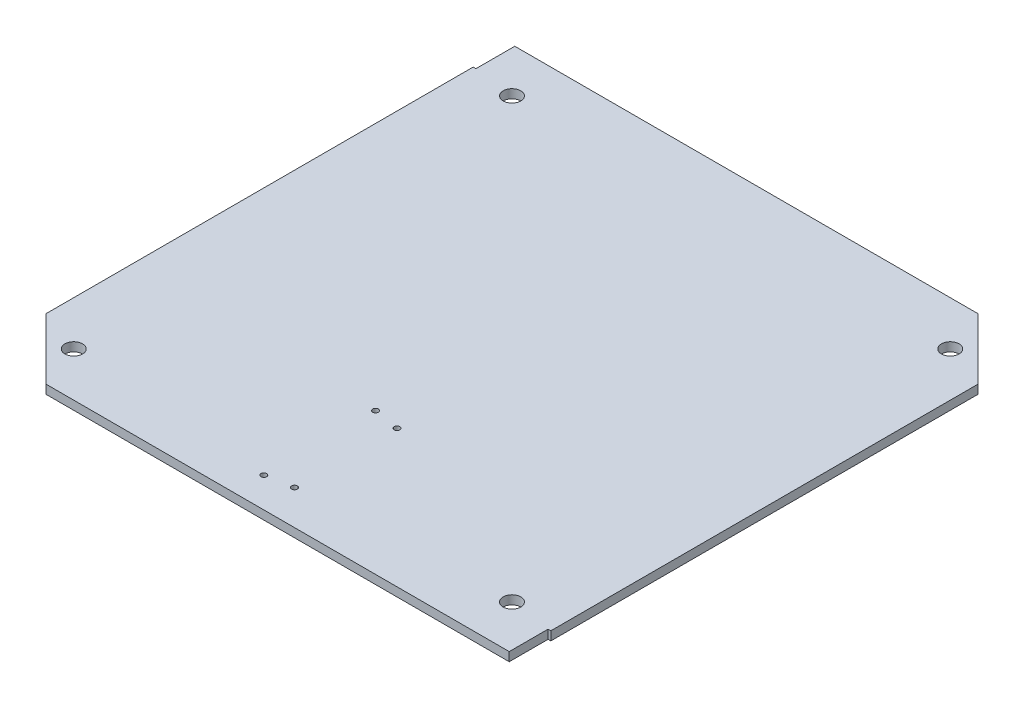
from build123d import *

# Parameters (mm, degrees)
BOSS_EXTRUDE1_DEPTH = 1.59
SKETCH2_R           = 1.59
SKETCH2_R_2         = 0.51
CUT_EXTRUDE1_DEPTH  = 68.193958806


with BuildPart() as part:
    # Sketch1 → Boss-Extrude1 (new body)
    with BuildSketch(Plane(origin=(0, 0, 0), x_dir=(1, 0, 0), z_dir=(0, 1, 0))):
        Polygon((-47.5, -36.5), (-36.5, -47.5), (47, -47.5), (47, -40.5), (47.5, -40.5), (47.5, 36.5), (36.5, 47.5), (-47, 47.5), (-47, 40.5), (-47.5, 40.5), align=None)
    extrude(amount=BOSS_EXTRUDE1_DEPTH)

    # Sketch2 → Cut-Extrude1 (cut, through all)
    with BuildSketch(Plane(origin=(0, 1.59, 0), x_dir=(1, 0, 0), z_dir=(0, 1, 0))):
        with Locations(Location((-39.5, -39.5, 0), (0, 0, 270))):
            Circle(SKETCH2_R)
        with Locations(Location((-39.5, 39.5, 0), (0, 0, 270))):
            Circle(SKETCH2_R)
        with Locations(Location((39.5, 39.5, 0), (0, 0, 270))):
            Circle(SKETCH2_R)
        with Locations(Location((39.5, -39.5, 0), (0, 0, 270))):
            Circle(SKETCH2_R)
        with Locations(Location((-2.67, -21.93, 0), (0, 0, 270))):
            Circle(SKETCH2_R_2)
        with Locations(Location((2.03, -22.75, 0), (0, 0, 270))):
            Circle(SKETCH2_R_2)
        with Locations(Location((-2.67, -42.07, 0), (0, 0, 270))):
            Circle(SKETCH2_R_2)
        with Locations(Location((2.03, -41.24, 0), (0, 0, 270))):
            Circle(SKETCH2_R_2)
    extrude(amount=-CUT_EXTRUDE1_DEPTH, mode=Mode.SUBTRACT)


solid = part.part
